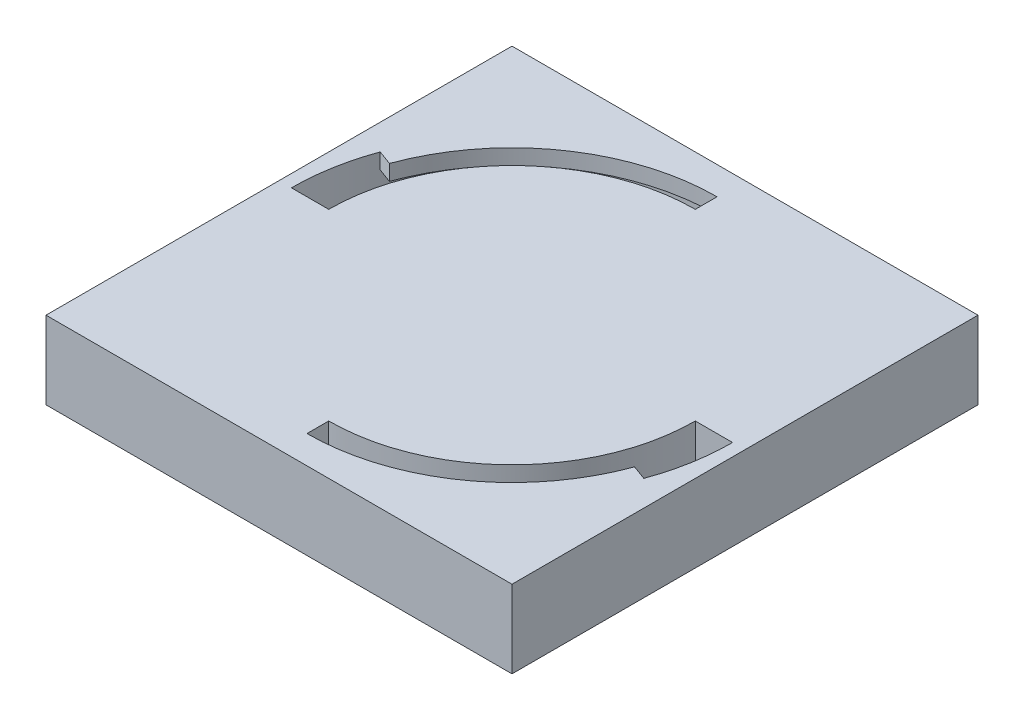
from build123d import *

# Parameters (mm, degrees)
SKETCH1_W           = 30
SKETCH1_H           = 30
BOSS_EXTRUDE1_DEPTH = 5
CUT_REVOLVE2_ANGLE  = 90
SKETCH2_5_W         = 2.4
SKETCH2_5_H         = 3
SKETCH2_5_W_2       = 1
SKETCH2_5_H_2       = 1
CUT_REVOLVE3_ANGLE  = 20


with BuildPart() as part:
    # Sketch1 → Boss-Extrude1 (new body)
    with BuildSketch(Plane(origin=(0, 0, 0), x_dir=(1, 0, 0), z_dir=(0, 1, 0))):
        with Locations((15, 15)):
            Rectangle(SKETCH1_W, SKETCH1_H)
    extrude(amount=BOSS_EXTRUDE1_DEPTH)

    # Sketch2 → Cut-Revolve2 (revolve, cut)
    with BuildSketch(Plane.XY.offset(-15)):
        Polygon((1.8, 4), (0.8, 4), (0.8, 2), (3.2, 2), (3.2, 5), (1.8, 5), align=None)
        Polygon((26.8, 2), (29.2, 2), (29.2, 4), (28.2, 4), (28.2, 5), (26.8, 5), align=None)
    revolve(axis=Axis((15, 5, -15), (0, -1, 0)), revolution_arc=CUT_REVOLVE2_ANGLE, mode=Mode.SUBTRACT)

    # Sketch2<5> → Cut-Revolve3 (revolve, cut)
    with BuildSketch(Plane.XY.offset(-15)):
        with Locations((2, 3.5)):
            Rectangle(SKETCH2_5_W, SKETCH2_5_H)
        with Locations((28.7, 4.5)):
            Rectangle(SKETCH2_5_W_2, SKETCH2_5_H_2)
    revolve(axis=Axis((15, 5, -15), (0, -1, 0)), revolution_arc=CUT_REVOLVE3_ANGLE, mode=Mode.SUBTRACT)


solid = part.part
